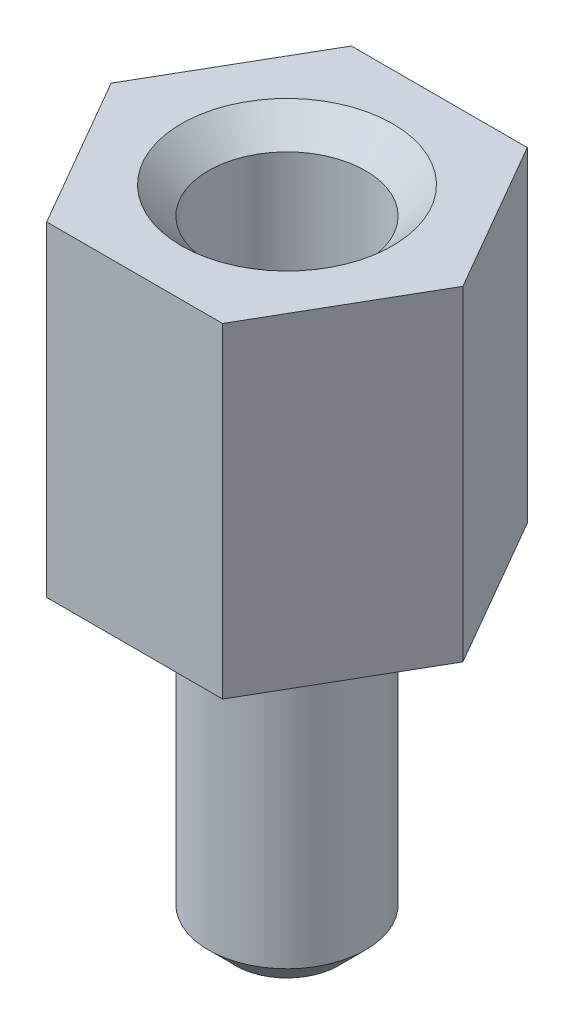
from build123d import *

# Parameters (mm, degrees)
BOSS_EXTRUDE1_DEPTH = 6
SKETCH2_R           = 1.45
BOSS_EXTRUDE2_DEPTH = 6
SKETCH3_R           = 1.45
CUT_EXTRUDE1_DEPTH  = 5
CHAMFER1_SIZE       = 0.5


with BuildPart() as part:
    # Sketch1 → Boss-Extrude1 (new body)
    with BuildSketch(Plane(origin=(0, 0, 0), x_dir=(1, 0, 0), z_dir=(0, 1, 0))):
        Polygon((3.244708513, 0), (1.622354256, 2.81), (-1.622354256, 2.81), (-3.244708513, 0), (-1.622354256, -2.81), (1.622354256, -2.81), align=None)
    extrude(amount=BOSS_EXTRUDE1_DEPTH)

    # Sketch2 → Boss-Extrude2 (add)
    with BuildSketch(Plane.XZ):
        with Locations(Location((0, 0, 0), (0, 0, 270))):
            Circle(SKETCH2_R)
    extrude(amount=BOSS_EXTRUDE2_DEPTH)

    # Sketch3 → Cut-Extrude1 (cut)
    with BuildSketch(Plane(origin=(0, 6, 0), x_dir=(1, 0, 0), z_dir=(0, 1, 0))):
        with Locations(Location((0, 0, 0), (0, 0, 90))):
            Circle(SKETCH3_R)
    extrude(amount=-CUT_EXTRUDE1_DEPTH, mode=Mode.SUBTRACT)

    # Chamfer1
    chamfer1_edges = [part.edges().sort_by_distance(p)[0] for p in [
        (0, -6, 1.45),
        (0, 6, 1.45),
    ]]
    chamfer(chamfer1_edges, length=CHAMFER1_SIZE)


solid = part.part
